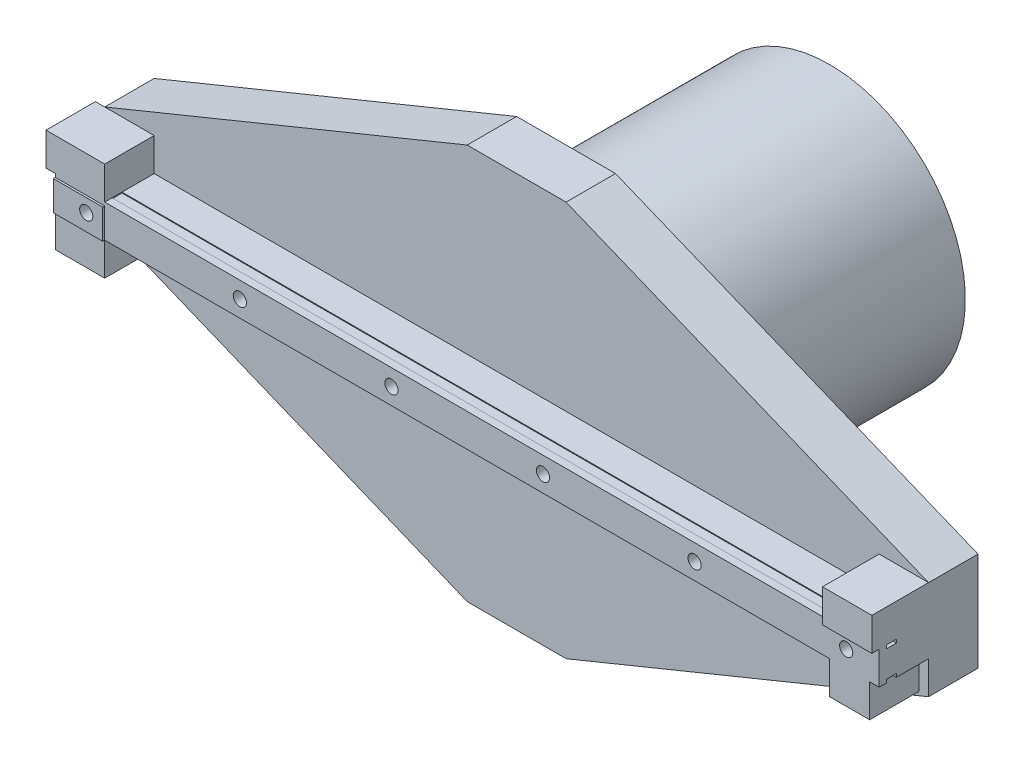
from build123d import *

# Parameters (mm, degrees)
SKETCH_1_W                  = 15
SKETCH_1_H                  = 15.60669
EXTRUDE_1_DEPTH             = 9
EXTRUDE_2_DEPTH             = 235
EXTRUDE_3_DEPTH             = 1
SKETCH_4_W                  = 15
SKETCH_4_H                  = 17.19706
EXTRUDE_4_DEPTH             = 10
SKETCH_5_W                  = 15
SKETCH_5_H                  = 3
CUT_EXTRUDE_1_DEPTH         = 1
SKETCH_6_W                  = 12.12351
SKETCH_6_H                  = 15
EXTRUDE_5_DEPTH             = 10
SKETCH_7_W                  = 15
SKETCH_7_H                  = 15
EXTRUDE_6_DEPTH             = 10
SKETCH_8_W                  = 15
SKETCH_8_H                  = 3
CUT_EXTRUDE_2_DEPTH         = 1
SKETCH_9_W                  = 17.81946
SKETCH_9_H                  = 15
EXTRUDE_7_DEPTH             = 10
EXTRUDE_8_DEPTH             = 15
SKETCH_11_W                 = 41.16167
SKETCH_11_H                 = 80
HOLE_WIZARD_10_0_10_1_D     = 10
HOLE_WIZARD_10_0_10_1_DEPTH = 50
HOLE_WIZARD_10_0_10_2_D     = 10
HOLE_WIZARD_10_0_10_2_DEPTH = 50
HOLE_WIZARD_4_0_4_1_D       = 4
HOLE_WIZARD_4_0_4_1_DEPTH   = 7.5
CHAMFER_1_SIZE              = 16.206633169
CHAMFER_1_EDGE_2_SIZE       = 16.206633169


with BuildPart() as part:
    # 草图1 → 凸台-拉伸1 (new body)
    with BuildSketch(Plane.XZ.offset(5)):
        with Locations((-117.5, 102.803345)):
            Rectangle(SKETCH_1_W, SKETCH_1_H)
    extrude(amount=-EXTRUDE_1_DEPTH)

    # 草图2 → 凸台-拉伸2 (add)
    with BuildSketch(Plane(origin=(-110, 0, 0), x_dir=(0, 0, -1), z_dir=(1, 0, 0))):
        Polygon((-95, 4.74906), (-95, -5), (-104.75, -5), (-104.75, -4), (-107.75, -4), (-107.75, -5), (-110, -5), (-110, 4.74906), align=None)
    extrude(amount=EXTRUDE_2_DEPTH)

    # 草图3 → 凸台-拉伸3 (add)
    with BuildSketch(Plane(origin=(0, 4, 0), x_dir=(-1, 0, 0), z_dir=(0, 1, 0))):
        Polygon((125, 95), (-125, 95), (-125, 110), (125, 110), (125, 107.75), (-110, 107.75), (-110, 104.75), (125, 104.75), align=None)
    extrude(amount=EXTRUDE_3_DEPTH)

    # 草图4 → 凸台-拉伸4 (add)
    with BuildSketch(Plane(origin=(0, 5, 0), x_dir=(-1, 0, 0), z_dir=(0, 1, 0))):
        with Locations((-117.5, 103.59853)):
            Rectangle(SKETCH_4_W, SKETCH_4_H)
    extrude(amount=EXTRUDE_4_DEPTH)

    # 草图5 → 切除-拉伸1 (cut)
    with BuildSketch(Plane.XZ.offset(-4)):
        with Locations((117.5, 106.25)):
            Rectangle(SKETCH_5_W, SKETCH_5_H)
    extrude(amount=-CUT_EXTRUDE_1_DEPTH, mode=Mode.SUBTRACT)

    # 草图6 → 凸台-拉伸5 (add)
    with BuildSketch(Plane.XZ.offset(5)):
        with Locations((116.061755, 102.5)):
            Rectangle(SKETCH_6_W, SKETCH_6_H)
    extrude(amount=EXTRUDE_5_DEPTH)

    # 草图7 → 凸台-拉伸6 (add)
    with BuildSketch(Plane.XZ.offset(5)):
        with Locations((-117.5, 102.5)):
            Rectangle(SKETCH_7_W, SKETCH_7_H)
    extrude(amount=EXTRUDE_6_DEPTH)

    # 草图8 → 切除-拉伸2 (cut)
    with BuildSketch(Plane(origin=(0, -4, 0), x_dir=(1, 0, 0), z_dir=(0, 1, 0))):
        with Locations((-117.5, -106.25)):
            Rectangle(SKETCH_8_W, SKETCH_8_H)
    extrude(amount=-CUT_EXTRUDE_2_DEPTH, mode=Mode.SUBTRACT)

    # 草图9 → 凸台-拉伸7 (add)
    with BuildSketch(Plane(origin=(0, 5, 0), x_dir=(-1, 0, 0), z_dir=(0, 1, 0))):
        with Locations((118.90973, 102.5)):
            Rectangle(SKETCH_9_W, SKETCH_9_H)
    extrude(amount=EXTRUDE_7_DEPTH)

    # 草图10 → 凸台-拉伸8 (add)
    with BuildSketch(Plane(origin=(0, 0, 95), x_dir=(-1, 0, 0), z_dir=(0, 0, -1))):
        Polygon((0, 66.136363636), (125, 15), (125, -15), (0, -66.136363636), (-125, -15), (-125, 15), align=None)
    extrude(amount=EXTRUDE_8_DEPTH)

    # 草图11 → 旋转1 (revolve)
    with BuildSketch(Plane.XZ, mode=Mode.PRIVATE) as revolve_1_sk:
        with Locations((20.580835, 40)):
            Rectangle(SKETCH_11_W, SKETCH_11_H)
    revolve(revolve_1_sk.sketch.rotate(Axis((0, 0, 80), (0, 0, -1)), 180), axis=Axis((0, 0, 80), (0, 0, -1)))

    # Ø10.0 (10) 直径孔1
    with Locations(Plane(origin=(-41.16167, 0, 10), x_dir=(0, 0, -1), z_dir=(-1, 0, 0))):
        with Locations((0, 0)):
            Hole(HOLE_WIZARD_10_0_10_1_D / 2, depth=HOLE_WIZARD_10_0_10_1_DEPTH)

    # Ø10.0 (10) 直径孔2
    with Locations(Plane(origin=(0, -41.16167, 10), x_dir=(-1, 0, 0), z_dir=(0, -1, 0))):
        with Locations((0, 0)):
            Hole(HOLE_WIZARD_10_0_10_2_D / 2, depth=HOLE_WIZARD_10_0_10_2_DEPTH)

    # Ø4.0 (4) 直径孔1
    with Locations(Plane.XY.offset(110.60669)):
        with Locations((115, 0), (69, 0), (23, 0), (-23, 0), (-69, 0), (-115, 0)):
            Hole(HOLE_WIZARD_4_0_4_1_D / 2, depth=HOLE_WIZARD_4_0_4_1_DEPTH)

    # 倒角1
    chamfer_1_edges = [part.edges().sort_by_distance(p)[0] for p in [
        (0, 66.136363636, 87.5),
    ]]
    chamfer(chamfer_1_edges, length=CHAMFER_1_SIZE)

    # 倒角1 edge 2
    chamfer_1_edge_2_edges = [part.edges().sort_by_distance(p)[0] for p in [
        (0, -66.136363636, 87.5),
    ]]
    chamfer(chamfer_1_edge_2_edges, length=CHAMFER_1_EDGE_2_SIZE)


solid = part.part
